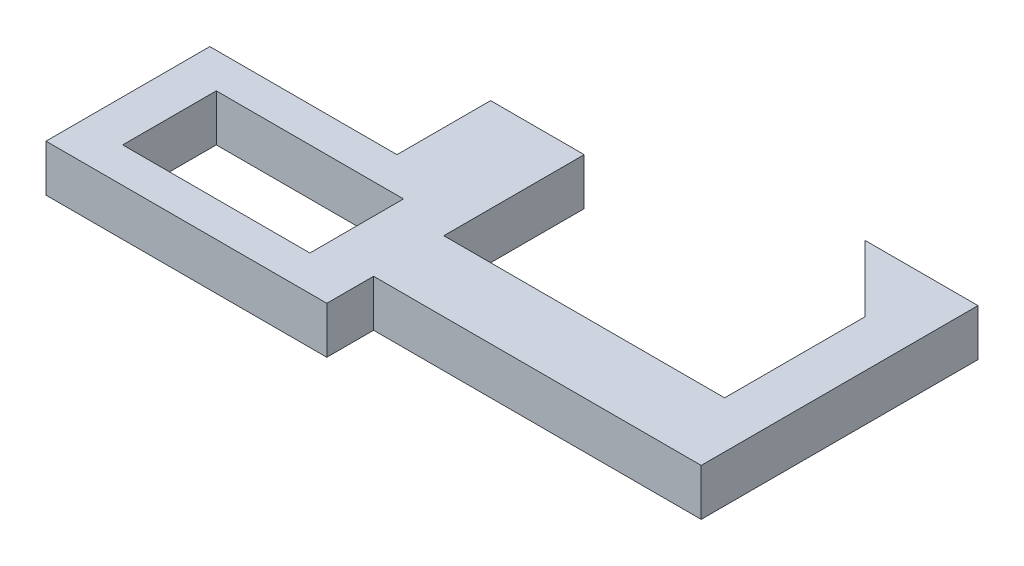
from build123d import *

# Parameters (mm, degrees)
BOSS_EXTRUDE1_DEPTH = 0.5


with BuildPart() as part:
    # Sketch1 → Boss-Extrude1 (new body)
    with BuildSketch(Plane(origin=(0, 0, 0), x_dir=(1, 0, 0), z_dir=(0, 1, 0))):
        Polygon((-24.973296771, 22.192182778), (-27.973296771, 22.192182778), (-27.973296771, 23.692182778), (-28.973296771, 23.692182778), (-28.973296771, 22.692182778), (-30.973296771, 22.692182778), (-30.973296771, 21.817182778), (-30.973296771, 20.942182778), (-27.973296771, 20.942182778), (-27.973296771, 21.442182778), (-24.473296771, 21.442182778), (-24.473296771, 24.399289559), (-25.680403552, 24.399289559), (-24.973296771, 23.692182778), align=None)
        Polygon((-30.528845953, 21.317182778), (-30.528845953, 21.817182778), (-30.528845953, 22.317182778), (-28.528845953, 22.317182778), (-28.528845953, 21.317182778), align=None, mode=Mode.SUBTRACT)
    extrude(amount=BOSS_EXTRUDE1_DEPTH)


solid = part.part
